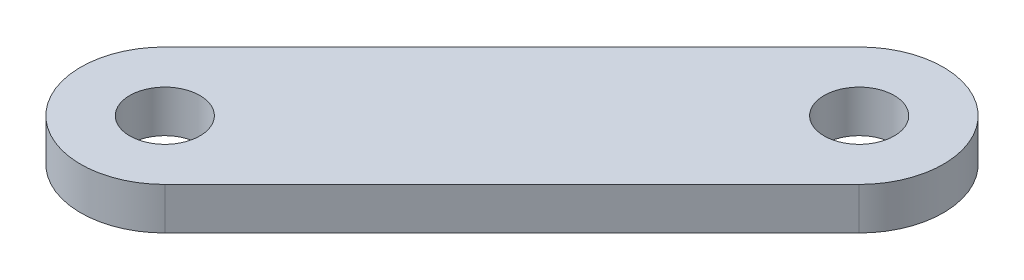
from build123d import *

# Parameters (mm, degrees)
ESQUISSE1_R        = 2.5
BOSS_EXTRU_1_DEPTH = 3


with BuildPart() as part:
    # Esquisse1 → Boss.-Extru.1 (new body)
    with BuildSketch(Plane(origin=(0, 39, 0), x_dir=(1, 0, 0), z_dir=(0, 1, 0))):
        with BuildLine():
            Line((27.930921382, -12.338300421), (3.182184041, -37.087037763))
            ThreePointArc((3.182184041, -37.087037763), (3.182184041, -45.572319137), (11.667465415, -45.572319137))
            Line((11.667465415, -45.572319137), (36.416202756, -20.823581795))
            ThreePointArc((36.416202756, -20.823581795), (36.416202756, -12.338300421), (27.930921382, -12.338300421))
        make_face()
        with Locations(Location((32.173562069, -16.580941108, 0), (0, 0, 270))):
            Circle(ESQUISSE1_R, mode=Mode.SUBTRACT)
        with Locations(Location((7.424824728, -41.32967845, 0), (0, 0, 270))):
            Circle(ESQUISSE1_R, mode=Mode.SUBTRACT)
    extrude(amount=BOSS_EXTRU_1_DEPTH)


solid = part.part
